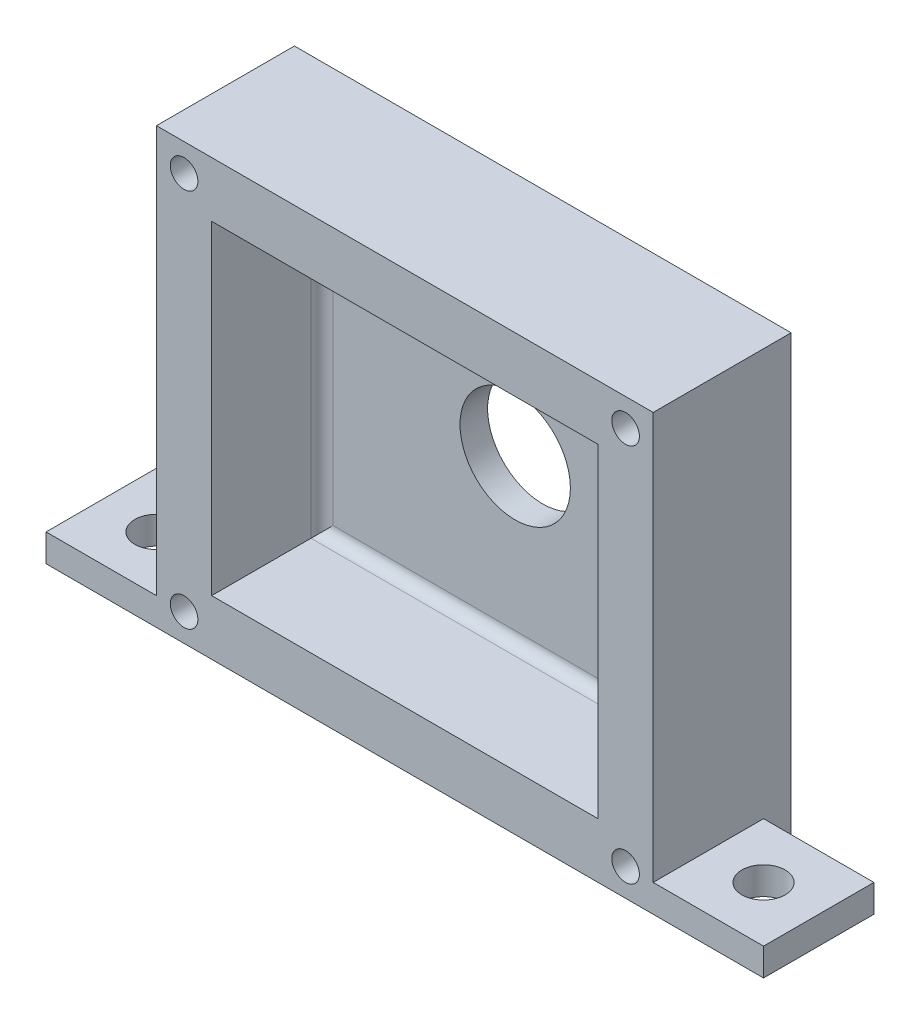
from build123d import *

# Parameters (mm, degrees)
SKETCH1_W           = 57.15
SKETCH1_H           = 50.00625
SKETCH1_W_2         = 44.45
SKETCH1_H_2         = 37.30625
BOSS_EXTRUDE1_DEPTH = 12.7
SKETCH2_W           = 57.15
SKETCH2_H           = 50.00625
SKETCH2_R           = 6.35
BOSS_EXTRUDE2_DEPTH = 3.175
SKETCH4_W           = 12.7
SKETCH4_H           = 3.175
BOSS_EXTRUDE3_DEPTH = 12.7
SKETCH5_R           = 2.4892
CUT_EXTRUDE1_DEPTH  = 3.175
FILLET1_R           = 1.27
SKETCH6_R           = 1.5875
CUT_EXTRUDE2_DEPTH  = 9.525


with BuildPart() as part:
    # Sketch1 → Boss-Extrude1 (new body)
    with BuildSketch(Plane.XY):
        Rectangle(SKETCH1_W, SKETCH1_H)
        Rectangle(SKETCH1_W_2, SKETCH1_H_2, mode=Mode.SUBTRACT)
    extrude(amount=BOSS_EXTRUDE1_DEPTH)

    # Sketch2 → Boss-Extrude2 (add)
    with BuildSketch(Plane.XY):
        Rectangle(SKETCH2_W, SKETCH2_H)
        Circle(SKETCH2_R, mode=Mode.SUBTRACT)
    extrude(amount=-BOSS_EXTRUDE2_DEPTH)

    # Sketch4 → Boss-Extrude3 (add)
    with BuildSketch(Plane.XY):
        with Locations((-34.925, -23.415625)):
            Rectangle(SKETCH4_W, SKETCH4_H)
        with Locations((34.925, -23.415625)):
            Rectangle(SKETCH4_W, SKETCH4_H)
    extrude(amount=BOSS_EXTRUDE3_DEPTH)

    # Sketch5 → Cut-Extrude1 (cut)
    with BuildSketch(Plane(origin=(0, -21.828125, 0), x_dir=(1, 0, 0), z_dir=(0, 1, 0))):
        with Locations(Location((-34.925, -6.35, 0), (0, 0, 180))):
            Circle(SKETCH5_R)
        with Locations(Location((34.925, -6.35, 0), (0, 0, 180))):
            Circle(SKETCH5_R)
    extrude(amount=-CUT_EXTRUDE1_DEPTH, mode=Mode.SUBTRACT)

    # Fillet1
    fillet1_edges = [part.edges().sort_by_distance(p)[0] for p in [
        (-22.225, 0, 0),
        (0, -18.653125, 0),
        (22.225, 0, 0),
        (0, 18.653125, 0),
    ]]
    fillet(fillet1_edges, radius=FILLET1_R)

    # Sketch6 → Cut-Extrude2 (cut)
    with BuildSketch(Plane.XY.offset(12.7)):
        with Locations((-25.4, 21.828125)):
            Circle(SKETCH6_R)
        with Locations((25.4, 21.828125)):
            Circle(SKETCH6_R)
        with Locations((25.4, -21.828125)):
            Circle(SKETCH6_R)
        with Locations((-25.4, -21.828125)):
            Circle(SKETCH6_R)
    extrude(amount=-CUT_EXTRUDE2_DEPTH, mode=Mode.SUBTRACT)


solid = part.part
